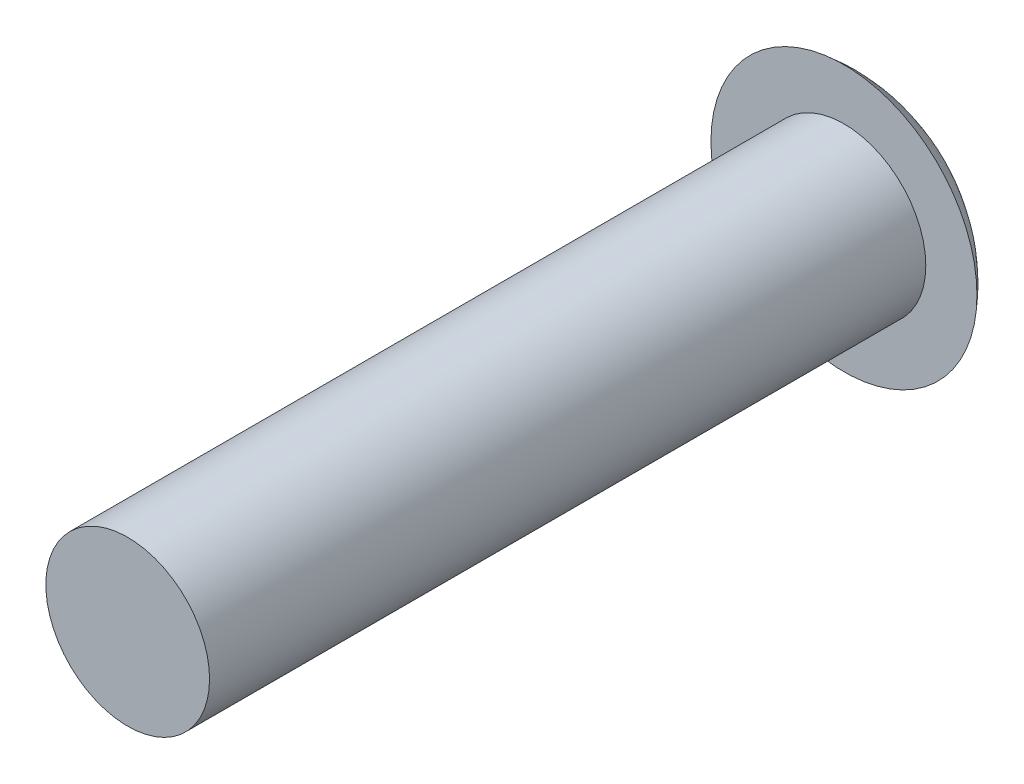
from build123d import *


with BuildPart() as part:
    # Sketch1 → Revolve1 (revolve)
    with BuildSketch(Plane(origin=(0, 0, 0), x_dir=(1, 0, 0), z_dir=(0, 1, 0)), mode=Mode.PRIVATE) as revolve1_sk:
        with BuildLine():
            Line((0, 0), (-1.6, 0))
            Line((-1.6, 0), (-1.6, 14))
            Line((-1.6, 14), (-2.6, 14))
            ThreePointArc((-2.6, 14), (-1.662970335, 14.737237703), (-0.5, 15))
            Line((-0.5, 15), (0, 15))
            Line((0, 15), (0, 0))
        make_face()
    revolve(revolve1_sk.sketch.rotate(Axis((0, 0, 0), (0, 0, -1)), 180), axis=Axis((0, 0, 0), (0, 0, -1)))


solid = part.part
